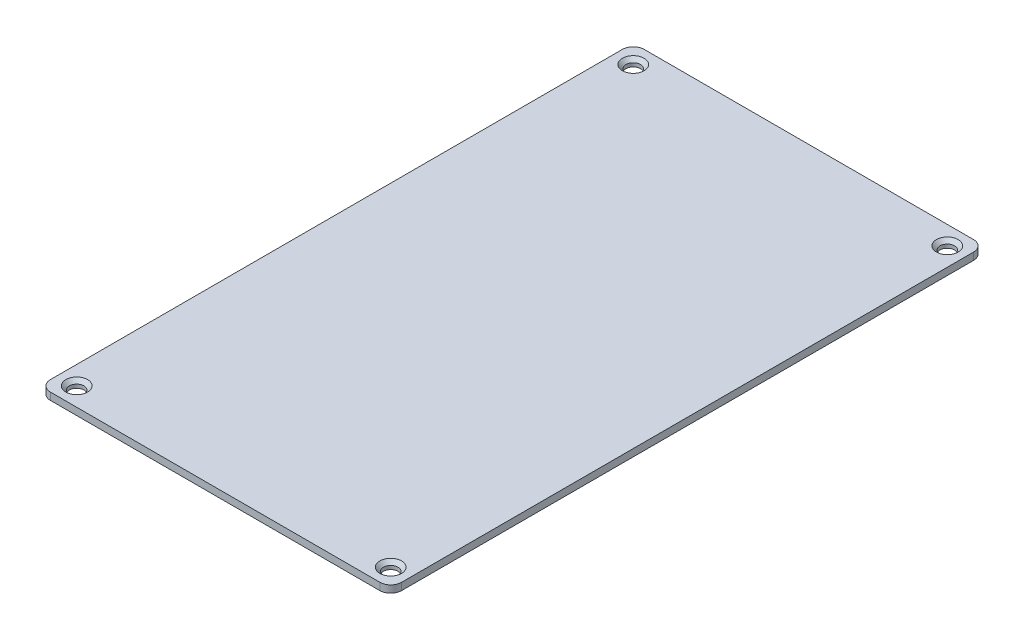
from build123d import *

# Parameters (mm, degrees)
SKETCH2_R           = 2
BOSS_EXTRUDE1_DEPTH = 2
FILLET13_R          = 3
CHAMFER1_SIZE       = 1


with BuildPart() as part:
    # Sketch2 → Boss-Extrude1 (new body)
    # profile 1 of 2: a face of its own
    with BuildSketch(Plane(origin=(0, 0, 0), x_dir=(1, 0, 0), z_dir=(0, 1, 0))):
        Polygon((-2, -2), (-2, 37.5), (-2, 137.5), (-2, 162), (95, 162), (95, -2), align=None)
        Polygon((0, 137.5), (0, 160), (93, 160), (93, 0), (0, 0), (0, 37.5), align=None, mode=Mode.SUBTRACT)
    # profile 2 of 2: a face of its own
    with BuildSketch(Plane(origin=(0, 0, 0), x_dir=(1, 0, 0), z_dir=(0, 1, 0))):
        Polygon((0, 160), (93, 160), (93, 0), (0, 0), (0, 37.5), (0, 137.5), align=None)
        with Locations(Location((89.87897445, 156.87897445, 0), (0, 0, 270))):
            Circle(SKETCH2_R, mode=Mode.SUBTRACT)
        with Locations(Location((89.87897445, 3.12102555, 0), (0, 0, 270))):
            Circle(SKETCH2_R, mode=Mode.SUBTRACT)
        with Locations(Location((3.12102555, 3.12102555, 0), (0, 0, 270))):
            Circle(SKETCH2_R, mode=Mode.SUBTRACT)
        with Locations(Location((3.12102555, 156.87897445, 0), (0, 0, 270))):
            Circle(SKETCH2_R, mode=Mode.SUBTRACT)
    extrude(amount=BOSS_EXTRUDE1_DEPTH)

    # Fillet13
    fillet13_edges = [part.edges().sort_by_distance(p)[0] for p in [
        (-2, 1, -162),
        (95, 1, -162),
        (95, 1, 2),
        (-2, 1, 2),
    ]]
    fillet(fillet13_edges, radius=FILLET13_R)

    # Chamfer1
    chamfer1_edges = [part.edges().sort_by_distance(p)[0] for p in [
        (89.87897445, 2, -158.87897445),
        (89.87897445, 2, -5.12102555),
        (3.12102555, 2, -5.12102555),
        (3.12102555, 2, -158.87897445),
    ]]
    chamfer(chamfer1_edges, length=CHAMFER1_SIZE)


solid = part.part
